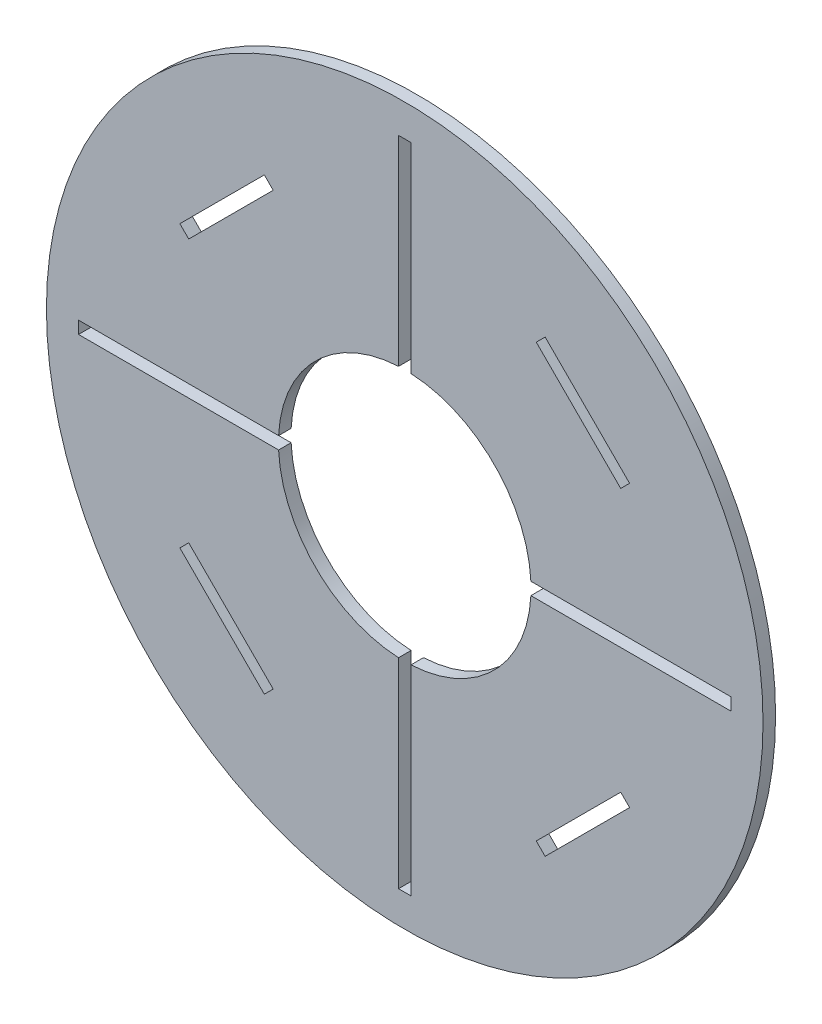
from build123d import *

# Parameters (mm, degrees)
SKETCH1_R           = 152.4
SKETCH1_R_2         = 53.721
BOSS_EXTRUDE1_DEPTH = 5.334
CUT_EXTRUDE2_REACH  = 217.592
CIRPATTERN1_COUNT   = 4
CUT_EXTRUDE3_REACH  = 217.592
CIRPATTERN2_COUNT   = 4


with BuildPart() as part:
    # Sketch1 → Boss-Extrude1 (new body)
    with BuildSketch(Plane.XY):
        Circle(SKETCH1_R)
        Circle(SKETCH1_R_2, mode=Mode.SUBTRACT)
    extrude(amount=BOSS_EXTRUDE1_DEPTH)

    # Sketch2 → Cut-Extrude2 (cut, up to next)
    with BuildSketch(Plane.XY.offset(5.334), mode=Mode.PRIVATE) as cut_extrude2_sk1:
        with BuildLine():
            Line((-2.6416, 53.656013553), (-2.6416, 138.746013553))
            Line((-2.6416, 138.746013553), (2.6416, 138.746013553))
            Line((2.6416, 138.746013553), (2.6416, 53.656013553))
            ThreePointArc((2.6416, 53.656013553), (0, 53.721), (-2.6416, 53.656013553))
        make_face()
    cut_extrude2_tool1 = extrude(cut_extrude2_sk1.sketch, amount=-CUT_EXTRUDE2_REACH, mode=Mode.PRIVATE) & part.part
    cut_extrude2 = cut_extrude2_tool1.solids().sort_by_distance((0, 96.222676, 5.334))[0]
    add(cut_extrude2, mode=Mode.SUBTRACT)

    # CirPattern1: Cut-Extrude2 ×4 about axis
    cirpattern1_axis = Axis((0, 0, 0), (0, 0, 1))
    for i in range(1, CIRPATTERN1_COUNT):
        add(cut_extrude2.rotate(cirpattern1_axis, i * 360 / CIRPATTERN1_COUNT), mode=Mode.SUBTRACT)

    # Sketch3 → Cut-Extrude3 (cut, up to next)
    with BuildSketch(Plane.XY.offset(5.334), mode=Mode.PRIVATE) as cut_extrude3_sk1:
        Polygon((-95.639727689, 59.718703205), (-59.718703205, 95.639727689), (-55.946995634, 91.868020119), (-91.868020119, 55.946995634), align=None)
    cut_extrude3_tool1 = extrude(cut_extrude3_sk1.sketch, amount=-CUT_EXTRUDE3_REACH, mode=Mode.PRIVATE) & part.part
    cut_extrude3 = cut_extrude3_tool1.solids().sort_by_distance((-75.793362, 75.793362, 5.334))[0]
    add(cut_extrude3, mode=Mode.SUBTRACT)

    # CirPattern2: Cut-Extrude3 ×4 about axis
    cirpattern2_axis = Axis((0, 0, 0), (0, 0, 1))
    for i in range(1, CIRPATTERN2_COUNT):
        add(cut_extrude3.rotate(cirpattern2_axis, i * 360 / CIRPATTERN2_COUNT), mode=Mode.SUBTRACT)


solid = part.part
